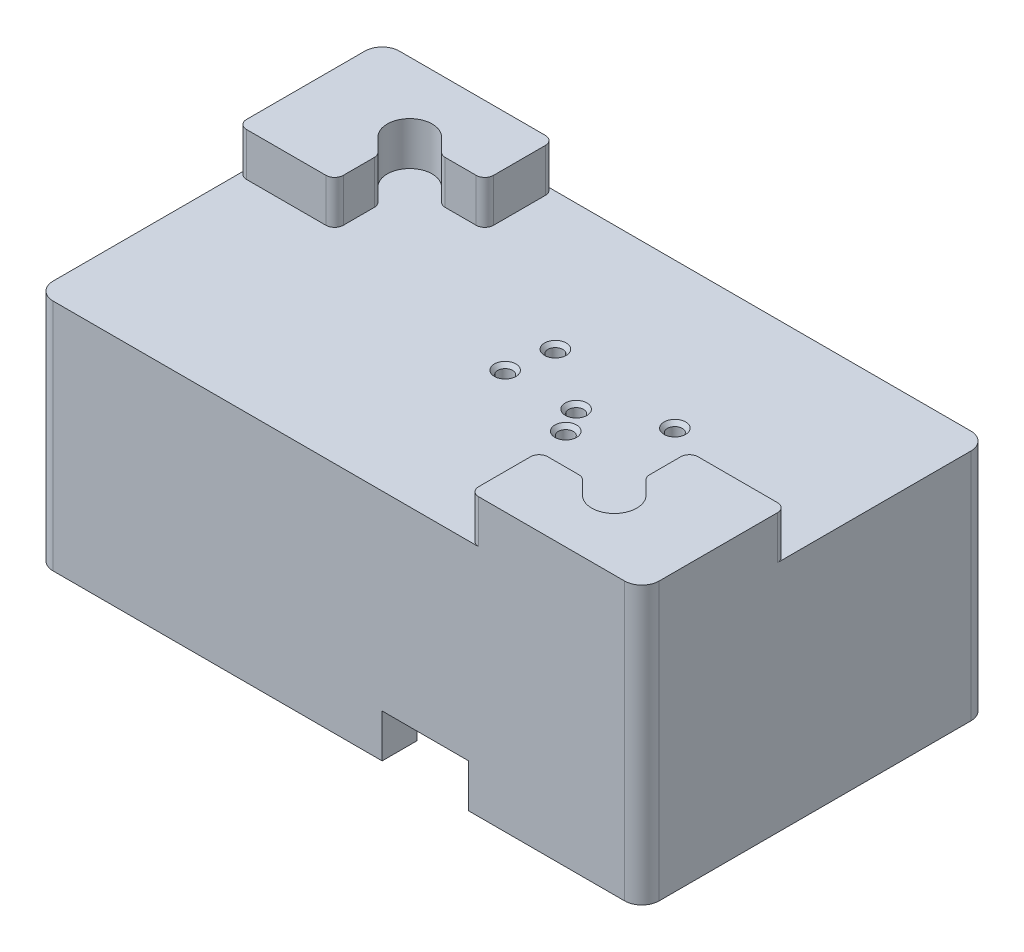
from build123d import *

# Parameters (mm, degrees)
SKETCH1_W                            = 44.45
SKETCH1_H                            = 25.4
BOSS_EXTRUDE1_DEPTH                  = 17.145
BOSS_EXTRUDE2_DEPTH                  = 3.175
CUT_EXTRUDE1_DEPTH                   = 3.175
F_57_0_043_DIAMETER_HOLE1_AT_2_COUNT = 2
F_57_0_043_DIAMETER_HOLE1_AT_2_PITCH = 5.663972193
F_57_0_043_DIAMETER_HOLE1_AT_3_COUNT = 2
F_57_0_043_DIAMETER_HOLE1_AT_3_PITCH = 5.39563203
F_57_0_043_DIAMETER_HOLE1_AT_4_COUNT = 2
F_57_0_043_DIAMETER_HOLE1_AT_4_PITCH = 10.226457647
F_57_0_043_DIAMETER_HOLE1_AT_5_COUNT = 2
F_57_0_043_DIAMETER_HOLE1_AT_5_PITCH = 9.419428274
FILLET1_R                            = 0.635
FILLET2_R                            = 1.27
FILLET3_R                            = 4.826


with BuildPart() as part:
    # Sketch1 → Boss-Extrude1 (new body)
    with BuildSketch(Plane(origin=(0, 0, 0), x_dir=(1, 0, 0), z_dir=(0, 1, 0))):
        Rectangle(SKETCH1_W, SKETCH1_H)
    extrude(amount=BOSS_EXTRUDE1_DEPTH)

    # Sketch2 → Boss-Extrude2 (add)
    with BuildSketch(Plane(origin=(0, 17.145, 0), x_dir=(1, 0, 0), z_dir=(0, 1, 0))):
        with BuildLine():
            Line((-22.225, 12.7), (-9.615133409, 12.7))
            Line((-9.615133409, 12.7), (-9.615133409, 7.625))
            Line((-9.615133409, 7.625), (-12.790133409, 7.625))
            Line((-12.790133409, 7.625), (-13.957566704, 8.792433296))
            ThreePointArc((-13.957566704, 8.792433296), (-16.292433296, 8.792433296), (-16.292433296, 6.457566704))
            Line((-16.292433296, 6.457566704), (-15.125, 5.290133409))
            Line((-15.125, 5.290133409), (-15.125, 2.115133409))
            Line((-15.125, 2.115133409), (-22.225, 2.115133409))
            Line((-22.225, 2.115133409), (-22.225, 12.7))
        make_face()
        with BuildLine():
            Line((22.225, -12.7), (22.225, -2.115133409))
            Line((22.225, -2.115133409), (15.125, -2.115133409))
            Line((15.125, -2.115133409), (15.125, -5.290133409))
            Line((15.125, -5.290133409), (16.292433296, -6.457566704))
            ThreePointArc((16.292433296, -6.457566704), (16.292433296, -8.792433296), (13.957566704, -8.792433296))
            Line((13.957566704, -8.792433296), (12.790133409, -7.625))
            Line((12.790133409, -7.625), (9.615133409, -7.625))
            Line((9.615133409, -7.625), (9.615133409, -12.7))
            Line((9.615133409, -12.7), (22.225, -12.7))
        make_face()
    extrude(amount=BOSS_EXTRUDE2_DEPTH)

    # Sketch6 → Cut-Extrude1 (cut)
    with BuildSketch(Plane.XZ):
        Polygon((3.175, 10.16), (3.175, 12.7), (9.525, 12.7), (9.525, 10.16), (19.685, 10.16), (19.685, -10.16), (-19.685, -10.16), (-19.685, 10.16), align=None)
    extrude(amount=-CUT_EXTRUDE1_DEPTH, mode=Mode.SUBTRACT)

    # Sketch4 → #57 (0.043) Diameter Hole1 (revolve, cut)
    with BuildSketch(Plane(origin=(9.92, 17.145, -2.025), x_dir=(0, 0, 1), z_dir=(1, 0, 0))):
        Polygon((0, 0), (0, 13.97), (0.79375, 13.97), (0.5461, 13.685111264), (0.5461, 0.284888736), (0.79375, 0), align=None)
    f_57_0_043_diameter_hole1 = revolve(axis=Axis((9.92, 23.495, -2.025), (0, -1, 0)), mode=Mode.SUBTRACT)

    # #57 (0.043) Diameter Hole1 at 2: #57 (0.043) Diameter Hole1 ×2
    with Locations(*[Vector(-0.6726727939963121, 0, 0.7399400733959441) * (i * F_57_0_043_DIAMETER_HOLE1_AT_2_PITCH) for i in range(1, F_57_0_043_DIAMETER_HOLE1_AT_2_COUNT)]):
        add(f_57_0_043_diameter_hole1, mode=Mode.SUBTRACT)

    # #57 (0.043) Diameter Hole1 at 3: #57 (0.043) Diameter Hole1 ×2
    with Locations(*[Vector(-0.894427190999916, 0, 0.447213595499958) * (i * F_57_0_043_DIAMETER_HOLE1_AT_3_PITCH) for i in range(1, F_57_0_043_DIAMETER_HOLE1_AT_3_COUNT)]):
        add(f_57_0_043_diameter_hole1, mode=Mode.SUBTRACT)

    # #57 (0.043) Diameter Hole1 at 4: #57 (0.043) Diameter Hole1 ×2
    with Locations(*[Vector(-0.968663866044045, 0, 0.24837535026770383) * (i * F_57_0_043_DIAMETER_HOLE1_AT_4_PITCH) for i in range(1, F_57_0_043_DIAMETER_HOLE1_AT_4_COUNT)]):
        add(f_57_0_043_diameter_hole1, mode=Mode.SUBTRACT)

    # #57 (0.043) Diameter Hole1 at 5: #57 (0.043) Diameter Hole1 ×2
    with Locations(*[Vector(-0.9977250982863921, 0, -0.06741385799232386) * (i * F_57_0_043_DIAMETER_HOLE1_AT_5_PITCH) for i in range(1, F_57_0_043_DIAMETER_HOLE1_AT_5_COUNT)]):
        add(f_57_0_043_diameter_hole1, mode=Mode.SUBTRACT)

    # Fillet1
    fillet1_edges = [part.edges().sort_by_distance(p)[0] for p in [
        (9.615133409, 18.7325, 12.7),
        (22.225, 18.7325, 2.115133409),
        (9.615133409, 18.7325, 7.625),
        (12.790133409, 18.7325, 7.625),
        (15.125, 18.7325, 5.290133409),
        (15.125, 18.7325, 2.115133409),
        (-9.615133409, 18.7325, -12.7),
        (-9.615133409, 18.7325, -7.625),
        (-12.790133409, 18.7325, -7.625),
        (-15.125, 18.7325, -5.290133409),
        (-15.125, 18.7325, -2.115133409),
        (-22.225, 18.7325, -2.115133409),
    ]]
    fillet(fillet1_edges, radius=FILLET1_R)

    # Fillet2
    fillet2_edges = [part.edges().sort_by_distance(p)[0] for p in [
        (22.225, 8.5725, -12.7),
        (22.225, 10.16, 12.7),
        (-22.225, 8.5725, 12.7),
        (-22.225, 10.16, -12.7),
    ]]
    fillet(fillet2_edges, radius=FILLET2_R)

    # Fillet3
    fillet3_edges = [part.edges().sort_by_distance(p)[0] for p in [
        (-19.685, 1.5875, 10.16),
        (19.685, 1.5875, 10.16),
        (19.685, 1.5875, -10.16),
        (-19.685, 1.5875, -10.16),
    ]]
    fillet(fillet3_edges, radius=FILLET3_R)


solid = part.part
